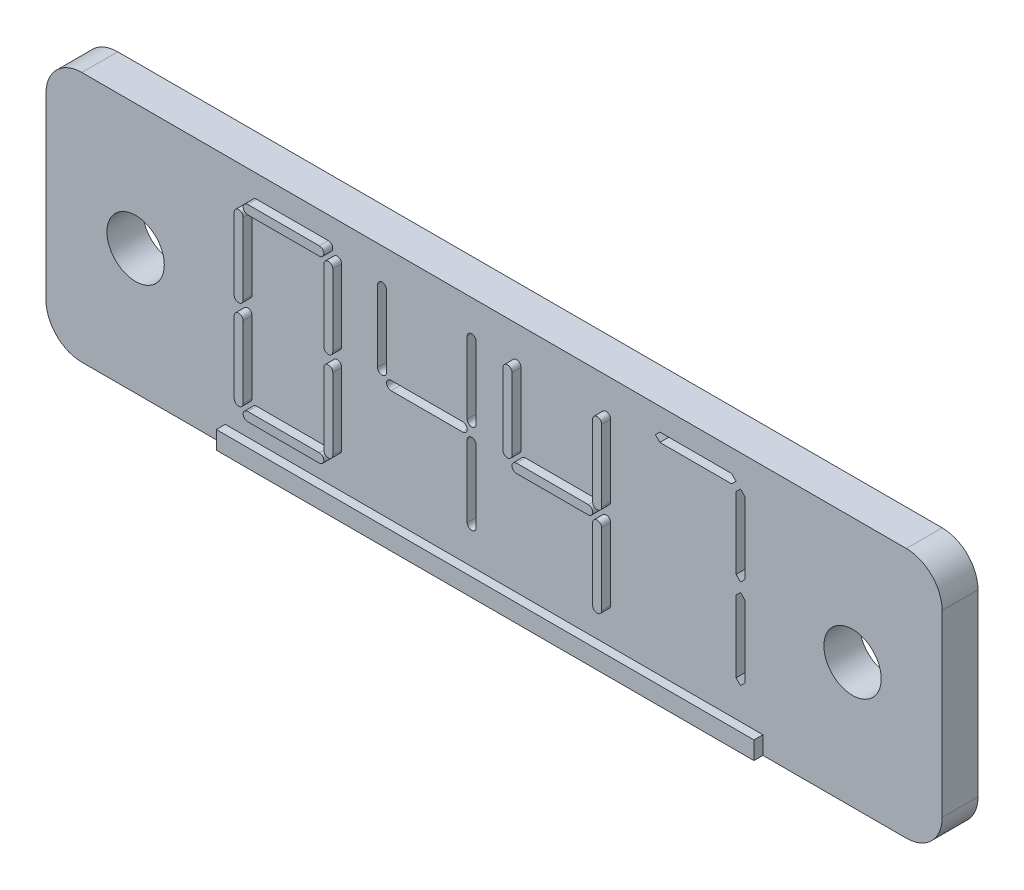
from build123d import *

# Parameters (mm, degrees)
SKETCH2_W           = 50
SKETCH2_H           = 14
BOSS_EXTRUDE1_DEPTH = 2.5
SKETCH4_OUTSIDE_W   = 62.396
SKETCH4_OUTSIDE_H   = 26.396
SKETCH4_OUTSIDE_W_2 = 30
SKETCH4_OUTSIDE_H_2 = 1
CUT_EXTRUDE1_DEPTH  = 0.5
SKETCH5_R           = 1.6
CUT_EXTRUDE2_DEPTH  = 2
FILLET2_R           = 2
CUT_EXTRUDE7_DEPTH  = 0.5
BOSS_EXTRUDE4_DEPTH = 0.5


with BuildPart() as part:
    # Sketch2 → Boss-Extrude1 (new body)
    with BuildSketch(Plane.XY):
        Rectangle(SKETCH2_W, SKETCH2_H)
    extrude(amount=BOSS_EXTRUDE1_DEPTH)

    # Sketch4 outside → Cut-Extrude1 (cut)
    with BuildSketch(Plane.XY.offset(2.5)):
        Rectangle(SKETCH4_OUTSIDE_W, SKETCH4_OUTSIDE_H)
        with Locations((0, -6.5)):
            Rectangle(SKETCH4_OUTSIDE_W_2, SKETCH4_OUTSIDE_H_2, mode=Mode.SUBTRACT)
    extrude(amount=-CUT_EXTRUDE1_DEPTH, mode=Mode.SUBTRACT)

    # Sketch5 → Cut-Extrude2 (cut)
    with BuildSketch(Plane.XY.offset(2)):
        with Locations((-20, 0)):
            Circle(SKETCH5_R)
        with Locations((20, 0)):
            Circle(SKETCH5_R)
    extrude(amount=-CUT_EXTRUDE2_DEPTH, mode=Mode.SUBTRACT)

    # Fillet2
    fillet2_edges = [part.edges().sort_by_distance(p)[0] for p in [
        (-25, -7, 1),
        (25, -7, 1),
        (25, 7, 1),
        (-25, 7, 1),
    ]]
    fillet(fillet2_edges, radius=FILLET2_R)

    # Sketch6 → Cut-Extrude7 (cut)
    with BuildSketch(Plane.XY.offset(2)):
        with BuildLine():
            Line((-5.75, 0.75), (-1.75, 0.75))
            ThreePointArc((-1.75, 0.75), (-1.5, 0.5), (-1.75, 0.25))
            Line((-1.75, 0.25), (-5.75, 0.25))
            ThreePointArc((-5.75, 0.25), (-6, 0.5), (-5.75, 0.75))
        make_face()
        with BuildLine():
            Line((-6.5, 1), (-6.5, 5))
            ThreePointArc((-6.5, 5), (-6.25, 5.25), (-6, 5))
            Line((-6, 5), (-6, 1))
            ThreePointArc((-6, 1), (-6.25, 0.75), (-6.5, 1))
        make_face()
        with BuildLine():
            Line((-1, 0), (-1, -4))
            ThreePointArc((-1, -4), (-1.25, -4.25), (-1.5, -4))
            Line((-1.5, -4), (-1.5, 0))
            ThreePointArc((-1.5, 0), (-1.25, 0.25), (-1, 0))
        make_face()
        with BuildLine():
            Line((-1.5, 1), (-1.5, 5))
            ThreePointArc((-1.5, 5), (-1.25, 5.25), (-1, 5))
            Line((-1, 5), (-1, 1))
            ThreePointArc((-1, 1), (-1.25, 0.75), (-1.5, 1))
        make_face()
        Polygon((14, 0), (14, -4), (13.75, -4.25), (13.5, -4), (13.5, 0), (13.75, 0.25), align=None)
        Polygon((13.25, 5.25), (9.25, 5.25), (9, 5.5), (9.25, 5.75), (13.25, 5.75), (13.5, 5.5), align=None)
        Polygon((13.5, 1), (13.5, 5), (13.75, 5.25), (14, 5), (14, 1), (13.75, 0.75), align=None)
    extrude(amount=-CUT_EXTRUDE7_DEPTH, mode=Mode.SUBTRACT)

    # Sketch6<10> → Boss-Extrude4 (add)
    with BuildSketch(Plane.XY.offset(2)):
        with BuildLine():
            Line((-9, 1), (-9, 5))
            ThreePointArc((-9, 5), (-8.75, 5.25), (-8.5, 5))
            Line((-8.5, 5), (-8.5, 1))
            ThreePointArc((-8.5, 1), (-8.75, 0.75), (-9, 1))
        make_face()
        with BuildLine():
            Line((-13.25, -4.25), (-9.25, -4.25))
            ThreePointArc((-9.25, -4.25), (-9, -4.5), (-9.25, -4.75))
            Line((-9.25, -4.75), (-13.25, -4.75))
            ThreePointArc((-13.25, -4.75), (-13.5, -4.5), (-13.25, -4.25))
        make_face()
        with BuildLine():
            Line((-13.25, 5.75), (-9.25, 5.75))
            ThreePointArc((-9.25, 5.75), (-9, 5.5), (-9.25, 5.25))
            Line((-9.25, 5.25), (-13.25, 5.25))
            ThreePointArc((-13.25, 5.25), (-13.5, 5.5), (-13.25, 5.75))
        make_face()
        with BuildLine():
            Line((-13.5, 0), (-13.5, -4))
            ThreePointArc((-13.5, -4), (-13.75, -4.25), (-14, -4))
            Line((-14, -4), (-14, 0))
            ThreePointArc((-14, 0), (-13.75, 0.25), (-13.5, 0))
        make_face()
        with BuildLine():
            Line((-14, 1), (-14, 5))
            ThreePointArc((-14, 5), (-13.75, 5.25), (-13.5, 5))
            Line((-13.5, 5), (-13.5, 1))
            ThreePointArc((-13.5, 1), (-13.75, 0.75), (-14, 1))
        make_face()
        with BuildLine():
            Line((-8.5, 0), (-8.5, -4))
            ThreePointArc((-8.5, -4), (-8.75, -4.25), (-9, -4))
            Line((-9, -4), (-9, 0))
            ThreePointArc((-9, 0), (-8.75, 0.25), (-8.5, 0))
        make_face()
        with BuildLine():
            Line((1.5, 1), (1.5, 5))
            ThreePointArc((1.5, 5), (1.25, 5.25), (1, 5))
            Line((1, 5), (1, 1))
            ThreePointArc((1, 1), (1.25, 0.75), (1.5, 1))
        make_face()
        with BuildLine():
            Line((1.75, 0.25), (5.75, 0.25))
            ThreePointArc((5.75, 0.25), (6, 0.5), (5.75, 0.75))
            Line((5.75, 0.75), (1.75, 0.75))
            ThreePointArc((1.75, 0.75), (1.5, 0.5), (1.75, 0.25))
        make_face()
        with BuildLine():
            Line((6.5, 1), (6.5, 5))
            ThreePointArc((6.5, 5), (6.25, 5.25), (6, 5))
            Line((6, 5), (6, 1))
            ThreePointArc((6, 1), (6.25, 0.75), (6.5, 1))
        make_face()
        with BuildLine():
            Line((6.5, 0), (6.5, -4))
            ThreePointArc((6.5, -4), (6.25, -4.25), (6, -4))
            Line((6, -4), (6, 0))
            ThreePointArc((6, 0), (6.25, 0.25), (6.5, 0))
        make_face()
    extrude(amount=BOSS_EXTRUDE4_DEPTH)


solid = part.part
